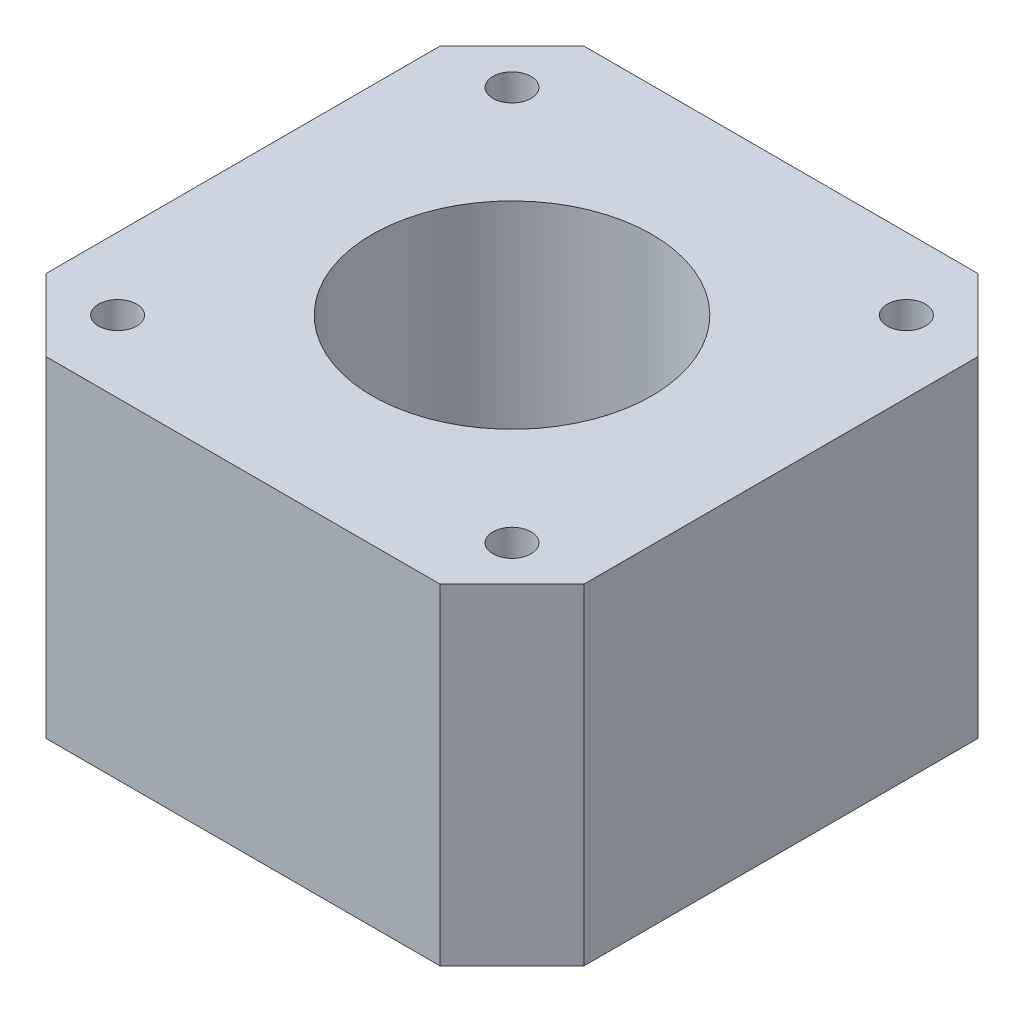
from build123d import *

# Parameters (mm, degrees)
SKETCH1_R           = 1.5
SKETCH1_R_2         = 11
BOSS_EXTRUDE1_DEPTH = 26
SKETCH1_3_R         = 1.5
BOSS_EXTRUDE2_DEPTH = 22.5


with BuildPart() as part:
    # Sketch1 → Boss-Extrude1 (new body)
    with BuildSketch(Plane(origin=(0, 0, 0), x_dir=(1, 0, 0), z_dir=(0, 1, 0))):
        Polygon((-15.493145751, 21.15), (-21.15, 15.493145751), (-21.15, -15.493145751), (-15.493145751, -21.15), (15.493145751, -21.15), (21.15, -15.493145751), (21.15, 15.493145751), (15.493145751, 21.15), align=None)
        with Locations(Location((-15.505, -15.505, 0), (0, 0, 90))):
            Circle(SKETCH1_R, mode=Mode.SUBTRACT)
        with Locations(Location((15.505, -15.505, 0), (0, 0, 90))):
            Circle(SKETCH1_R, mode=Mode.SUBTRACT)
        with Locations(Location((0, 0, 0), (0, 0, 90))):
            Circle(SKETCH1_R_2, mode=Mode.SUBTRACT)
        with Locations(Location((-15.505, 15.505, 0), (0, 0, 90))):
            Circle(SKETCH1_R, mode=Mode.SUBTRACT)
        with Locations(Location((15.505, 15.505, 0), (0, 0, 90))):
            Circle(SKETCH1_R, mode=Mode.SUBTRACT)
    extrude(amount=BOSS_EXTRUDE1_DEPTH)

    # Sketch1<3> → Boss-Extrude2 (add)
    with BuildSketch(Plane(origin=(0, 0, 0), x_dir=(1, 0, 0), z_dir=(0, 1, 0))):
        with Locations(Location((15.505, -15.505, 0), (0, 0, 90))):
            Circle(SKETCH1_3_R)
        with Locations(Location((-15.505, -15.505, 0), (0, 0, 90))):
            Circle(SKETCH1_3_R)
        with Locations(Location((15.505, 15.505, 0), (0, 0, 90))):
            Circle(SKETCH1_3_R)
        with Locations(Location((-15.505, 15.505, 0), (0, 0, 90))):
            Circle(SKETCH1_3_R)
    extrude(amount=BOSS_EXTRUDE2_DEPTH)


solid = part.part
